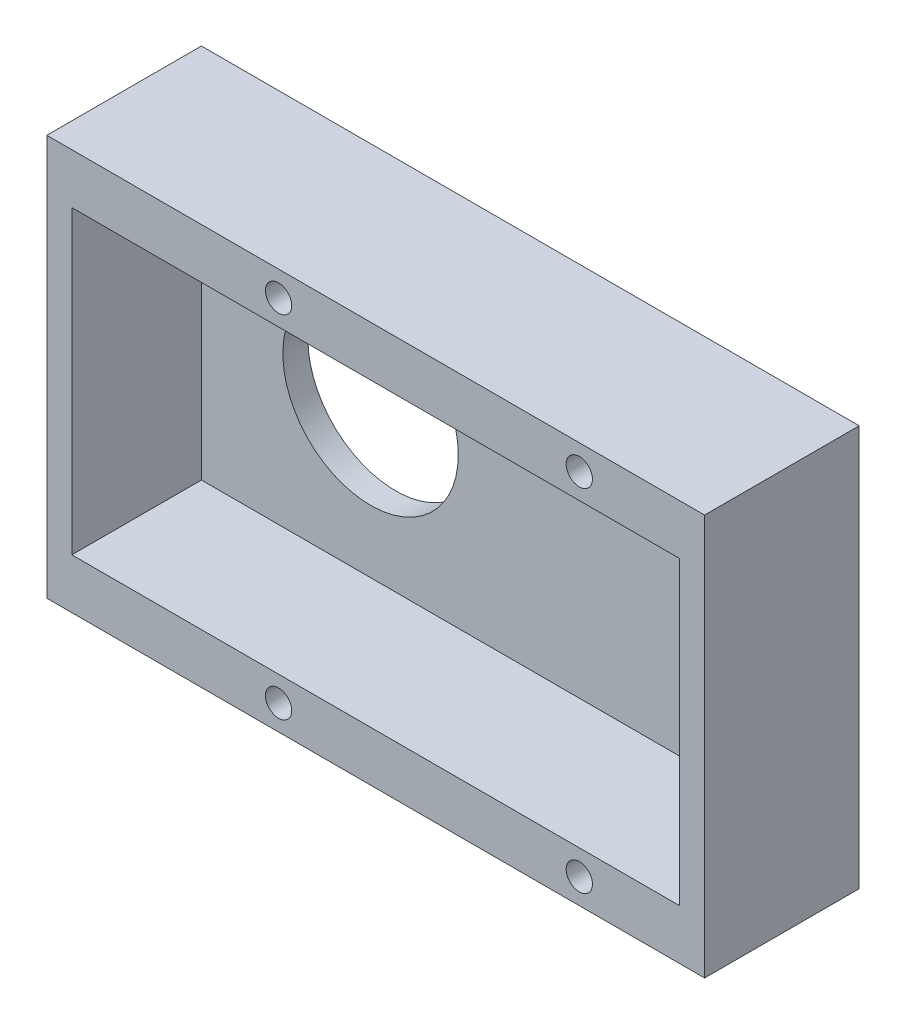
from build123d import *

# Parameters (mm, degrees)
SKETCH_1_W          = 52.5
SKETCH_1_H          = 32
EXTRUDE_1_DEPTH     = 2
SKETCH_2_W          = 52.5
SKETCH_2_H          = 32
SKETCH_2_W_2        = 48.5
SKETCH_2_H_2        = 24
EXTRUDE_2_DEPTH     = 10.34
CUT_EXTRUDE_1_REACH = 64.347
SKETCH_3_R          = 7
CUT_EXTRUDE_2_REACH = 64.71
SKETCH_4_R          = 1.05


with BuildPart() as part:
    # 草图1 → 凸台-拉伸1 (new body)
    with BuildSketch(Plane.XY):
        with Locations((26.25, 16)):
            Rectangle(SKETCH_1_W, SKETCH_1_H)
    extrude(amount=EXTRUDE_1_DEPTH)

    # 草图2 → 凸台-拉伸2 (add)
    with BuildSketch(Plane.XY.offset(2)):
        with Locations((26.25, 16)):
            Rectangle(SKETCH_2_W, SKETCH_2_H)
        with Locations((26.25, 16)):
            Rectangle(SKETCH_2_W_2, SKETCH_2_H_2, mode=Mode.SUBTRACT)
    extrude(amount=EXTRUDE_2_DEPTH)

    # 草图3 → 切除-拉伸1 (cut, up to next)
    with BuildSketch(Plane.XY.offset(2), mode=Mode.PRIVATE) as cut_extrude_1_sk1:
        with Locations((15.5, 16)):
            Circle(SKETCH_3_R)
    cut_extrude_1_tool1 = extrude(cut_extrude_1_sk1.sketch, amount=-CUT_EXTRUDE_1_REACH, mode=Mode.PRIVATE) & part.part
    add(cut_extrude_1_tool1.solids().sort_by_distance((15.5, 16, 2))[0], mode=Mode.SUBTRACT)

    # 草图4 → 切除-拉伸2 (cut, up to next)
    with BuildSketch(Plane.XY.offset(12.34), mode=Mode.PRIVATE) as cut_extrude_2_sk1:
        with Locations((18.5, 30)):
            Circle(SKETCH_4_R)
    cut_extrude_2_tool1 = extrude(cut_extrude_2_sk1.sketch, amount=-CUT_EXTRUDE_2_REACH, mode=Mode.PRIVATE) & part.part
    # 草图4 → 切除-拉伸2 (cut, up to next)
    with BuildSketch(Plane.XY.offset(12.34), mode=Mode.PRIVATE) as cut_extrude_2_sk2:
        with Locations(Location((42.5, 30, 0), (0, 0, 180))):
            Circle(SKETCH_4_R)
    cut_extrude_2_tool2 = extrude(cut_extrude_2_sk2.sketch, amount=-CUT_EXTRUDE_2_REACH, mode=Mode.PRIVATE) & part.part
    # 草图4 → 切除-拉伸2 (cut, up to next)
    with BuildSketch(Plane.XY.offset(12.34), mode=Mode.PRIVATE) as cut_extrude_2_sk3:
        with Locations((42.5, 2)):
            Circle(SKETCH_4_R)
    cut_extrude_2_tool3 = extrude(cut_extrude_2_sk3.sketch, amount=-CUT_EXTRUDE_2_REACH, mode=Mode.PRIVATE) & part.part
    # 草图4 → 切除-拉伸2 (cut, up to next)
    with BuildSketch(Plane.XY.offset(12.34), mode=Mode.PRIVATE) as cut_extrude_2_sk4:
        with Locations(Location((18.5, 2, 0), (0, 0, 180))):
            Circle(SKETCH_4_R)
    cut_extrude_2_tool4 = extrude(cut_extrude_2_sk4.sketch, amount=-CUT_EXTRUDE_2_REACH, mode=Mode.PRIVATE) & part.part
    add(cut_extrude_2_tool1.solids().sort_by_distance((18.5, 30, 12.34))[0], mode=Mode.SUBTRACT)
    add(cut_extrude_2_tool2.solids().sort_by_distance((42.5, 30, 12.34))[0], mode=Mode.SUBTRACT)
    add(cut_extrude_2_tool3.solids().sort_by_distance((42.5, 2, 12.34))[0], mode=Mode.SUBTRACT)
    add(cut_extrude_2_tool4.solids().sort_by_distance((18.5, 2, 12.34))[0], mode=Mode.SUBTRACT)


solid = part.part
